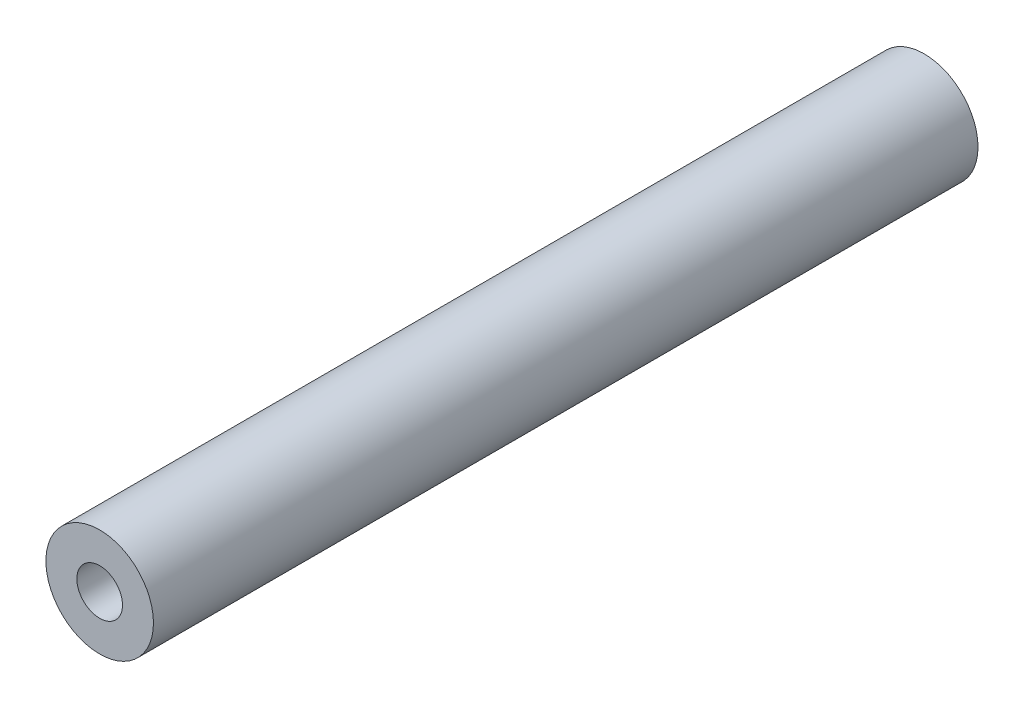
from build123d import *

# Parameters (mm, degrees)
SKETCH1_R                            = 4.7625
BOSS_EXTRUDE1_DEPTH                  = 36.5125
F_10_32_TAPPED_HOLE2_D               = 4.0386
F_10_32_TAPPED_HOLE2_DEPTH           = 12.02944
F_10_32_TAPPED_HOLE2_TIP             = 1.213317848
F_10_32_TAPPED_HOLE2_ON_FACE_2_D     = 4.0386
F_10_32_TAPPED_HOLE2_ON_FACE_2_DEPTH = 12.02944
F_10_32_TAPPED_HOLE2_ON_FACE_2_TIP   = 1.213317848


with BuildPart() as part:
    # Sketch1 → Boss-Extrude1 (new, symmetric)
    with BuildSketch(Plane.XY):
        Circle(SKETCH1_R)
    extrude(amount=BOSS_EXTRUDE1_DEPTH, both=True)

    # #10-32 Tapped Hole2
    with Locations(Plane(origin=(0, 0, -36.5125), x_dir=(-1, 0, 0), z_dir=(0, 0, -1))):
        with Locations((0, 0)):
            Hole(F_10_32_TAPPED_HOLE2_D / 2, depth=F_10_32_TAPPED_HOLE2_DEPTH)
            with Locations((0, 0, -(F_10_32_TAPPED_HOLE2_DEPTH + F_10_32_TAPPED_HOLE2_TIP / 2))):  # 118° drill point
                Cone(0, F_10_32_TAPPED_HOLE2_D / 2, F_10_32_TAPPED_HOLE2_TIP, mode=Mode.SUBTRACT)

    # #10-32 Tapped Hole2 on face 2
    with Locations(Plane.XY.offset(36.5125)):
        with Locations((0, 0)):
            Hole(F_10_32_TAPPED_HOLE2_ON_FACE_2_D / 2, depth=F_10_32_TAPPED_HOLE2_ON_FACE_2_DEPTH)
            with Locations((0, 0, -(F_10_32_TAPPED_HOLE2_ON_FACE_2_DEPTH + F_10_32_TAPPED_HOLE2_ON_FACE_2_TIP / 2))):  # 118° drill point
                Cone(0, F_10_32_TAPPED_HOLE2_ON_FACE_2_D / 2, F_10_32_TAPPED_HOLE2_ON_FACE_2_TIP, mode=Mode.SUBTRACT)


solid = part.part
